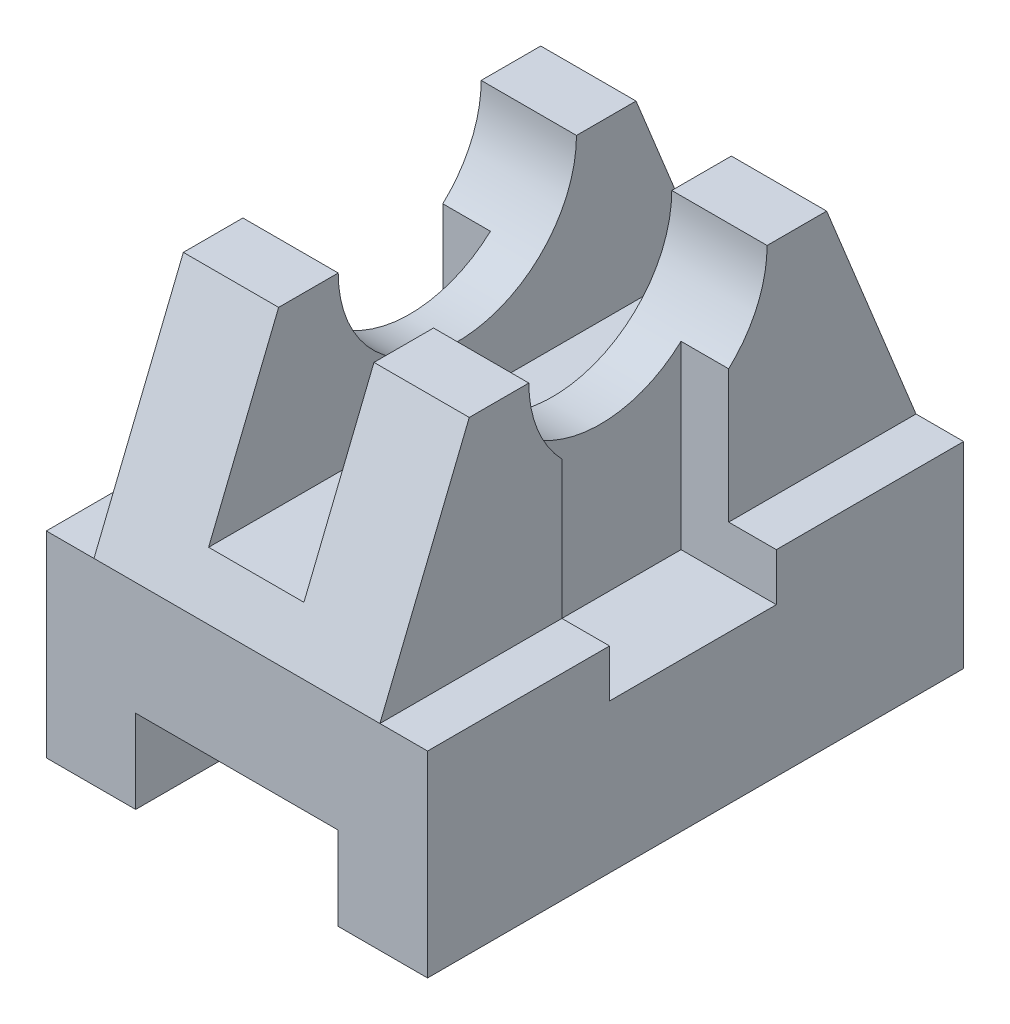
from build123d import *

# Parameters (mm, degrees)
BOSS_EXTRUDE1_DEPTH      = 135
BOSS_EXTRUDE2_DEPTH      = 36
BOSS_EXTRUDE2_DEPTH_BACK = 36
SKETCH3_W                = 24
SKETCH3_H                = 43.5
CUT_EXTRUDE1_DEPTH       = 178.634456117
SKETCH4_W                = 24
SKETCH4_H                = 42
CUT_EXTRUDE2_DEPTH       = 67.5


with BuildPart() as part:
    # Sketch1 → Boss-Extrude1 (new body)
    with BuildSketch(Plane.XY):
        Polygon((-48, 49.5), (-48, 0), (-25.5, 0), (-25.5, 21), (25.5, 21), (25.5, 0), (48, 0), (48, 49.5), align=None)
    extrude(amount=-BOSS_EXTRUDE1_DEPTH)

    # Sketch2 → Boss-Extrude2 (add, two sides: drawn at the far end of the back side and taken through both)
    with BuildSketch(Plane(origin=(0, 0, 0), x_dir=(0, 0, -1), z_dir=(1, 0, 0)).offset(-BOSS_EXTRUDE2_DEPTH_BACK)):
        with BuildLine():
            Line((37.5, 105), (22.5, 105))
            Line((22.5, 105), (0, 49.5))
            Line((0, 49.5), (135, 49.5))
            Line((135, 49.5), (112.5, 105))
            Line((112.5, 105), (97.5, 105))
            ThreePointArc((97.5, 105), (67.5, 75), (37.5, 105))
        make_face()
    extrude(amount=BOSS_EXTRUDE2_DEPTH + BOSS_EXTRUDE2_DEPTH_BACK)

    # Sketch3 → Cut-Extrude1 (cut, through all)
    with BuildSketch(Plane.XY):
        with Locations((0, 83.25)):
            Rectangle(SKETCH3_W, SKETCH3_H)
    extrude(amount=-CUT_EXTRUDE1_DEPTH, mode=Mode.SUBTRACT)

    # Sketch4 → Cut-Extrude2 (cut)
    with BuildSketch(Plane(origin=(0, 105, 0), x_dir=(1, 0, 0), z_dir=(0, 1, 0))):
        with Locations((36, 66.828706639)):
            Rectangle(SKETCH4_W, SKETCH4_H)
    cut_extrude2 = extrude(amount=-CUT_EXTRUDE2_DEPTH, mode=Mode.SUBTRACT)

    # Mirror1: Cut-Extrude2 across plane
    add(cut_extrude2.mirror(Plane(origin=(0, 0, 0), x_dir=(0, 0, 1), z_dir=(1, 0, 0))), mode=Mode.SUBTRACT)


solid = part.part
